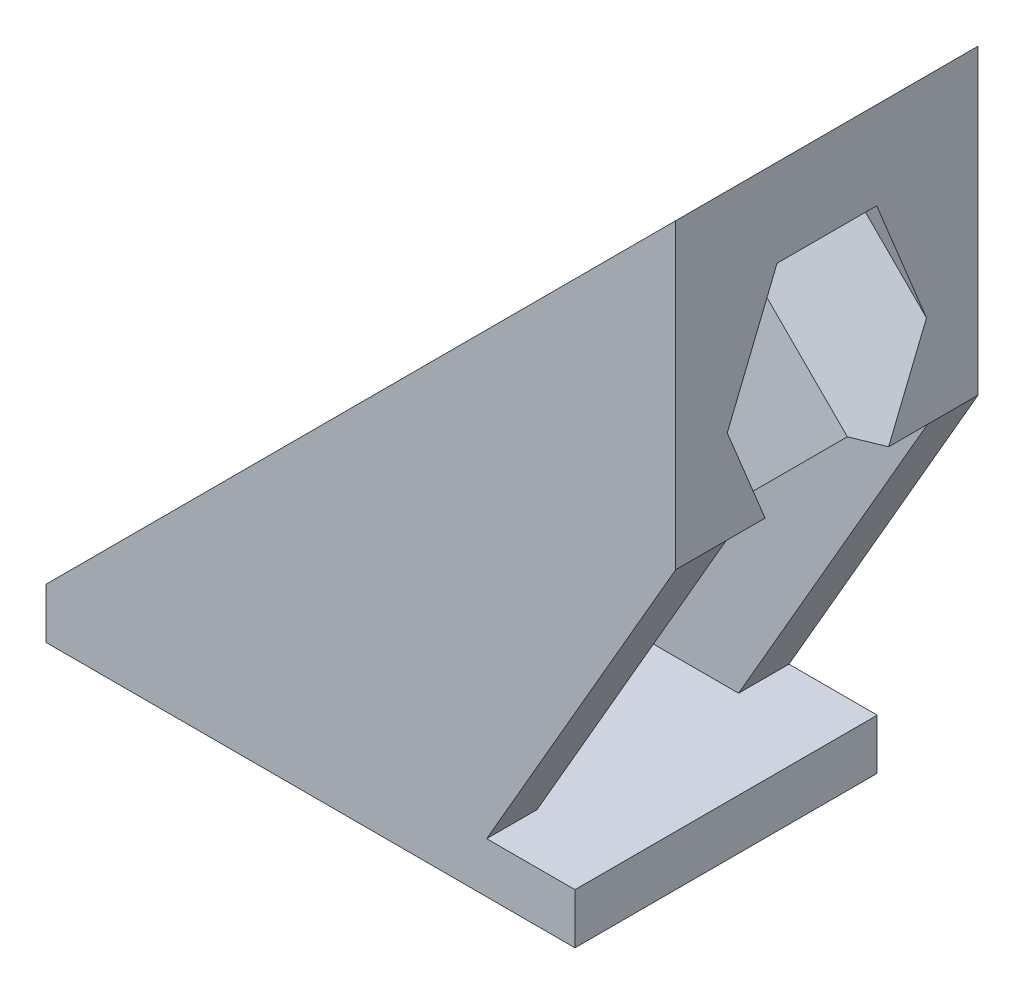
from build123d import *

# Parameters (mm, degrees)
SKETCH3_W           = 21
SKETCH3_H           = 2
BOSS_EXTRUDE1_DEPTH = 12
CUT_EXTRUDE1_START  = -2
CUT_EXTRUDE1_DEPTH  = 8
CUT_EXTRUDE8_START  = -2
CUT_EXTRUDE8_DEPTH  = 36.336309405
CUT_EXTRUDE9_DEPTH  = 38.336309405
CUT_EXTRUDE11_DEPTH = 2
FILLET1_R           = 10


with BuildPart() as part:
    # Sketch3 → Boss-Extrude1 (new body)
    with BuildSketch(Plane.XY):
        with Locations((10.5, -1)):
            Rectangle(SKETCH3_W, SKETCH3_H)
        Polygon((13, 13), (0, 0), (17.494446501, 0), (25, 13), align=None)
        Polygon((25, 25), (13, 13), (25, 13), align=None)
    extrude(amount=BOSS_EXTRUDE1_DEPTH)

    # Sketch4 → Cut-Extrude1 (cut)
    with BuildSketch(Plane.XY.offset(12).offset(CUT_EXTRUDE1_START)):
        Polygon((25, 13), (20, 13), (3, 0), (17.494446501, 0), align=None)
    extrude(amount=-CUT_EXTRUDE1_DEPTH, mode=Mode.SUBTRACT)

    # Sketch7 → Cut-Extrude8 (cut, through all)
    with BuildSketch(Plane(origin=(0, 0, 0), x_dir=(0, 0, 1), z_dir=(-0.7071067811865485, 0.7071067811865466, 0)).offset(CUT_EXTRUDE8_START)):
        Polygon((6, 26.047596513), (6, 32.897596513), (4.022575328, 32.897596513), (2.045150656, 29.472596513), (4.022575328, 26.047596513), align=None)
        Polygon((7.977424672, 32.897596513), (6, 32.897596513), (6, 26.047596513), (7.977424672, 26.047596513), (9.954849344, 29.472596513), align=None)
    extrude(amount=-CUT_EXTRUDE8_DEPTH, mode=Mode.SUBTRACT)

    # Sketch8 → Cut-Extrude9 (cut, through all)
    with BuildSketch(Plane(origin=(0, 0, 0), x_dir=(0, 0, 1), z_dir=(-0.7071067811865485, 0.7071067811865466, 0))):
        with BuildLine():
            ThreePointArc((8, 29.355339059), (7.414213562, 30.769552622), (6, 31.355339059))
            Line((6, 31.355339059), (6, 27.355339059))
            ThreePointArc((6, 27.355339059), (7.414213562, 27.941125497), (8, 29.355339059))
        make_face()
        with BuildLine():
            Line((6, 27.355339059), (6, 31.355339059))
            ThreePointArc((6, 31.355339059), (4, 29.355339059), (6, 27.355339059))
        make_face()
    extrude(amount=-CUT_EXTRUDE9_DEPTH, mode=Mode.SUBTRACT)

    # Sketch9 → Cut-Extrude11 (cut)
    with BuildSketch(Plane(origin=(0, 0, 0), x_dir=(1, 0, 0), z_dir=(0, 1, 0))):
        with BuildLine():
            ThreePointArc((7.24722325, -2), (5.358620419, -4.950446591), (5.869726291, -8.416096101))
            Line((5.869726291, -8.416096101), (8.496224466, -6.96643844))
            ThreePointArc((8.496224466, -6.96643844), (9.28078481, -4.249001216), (11.998222034, -5.03356156))
            Line((11.998222034, -5.03356156), (14.62472021, -3.583903899))
            ThreePointArc((14.62472021, -3.583903899), (14.020027676, -2.718849781), (13.24722325, -2))
            Line((13.24722325, -2), (7.24722325, -2))
        make_face()
        with BuildLine():
            Line((8.496224466, -6.96643844), (5.869726291, -8.416096101))
            ThreePointArc((5.869726291, -8.416096101), (6.474418824, -9.281150219), (7.24722325, -10))
            Line((7.24722325, -10), (13.24722325, -10))
            ThreePointArc((13.24722325, -10), (14.719359205, -8.236067977), (15.24722325, -6))
            ThreePointArc((15.24722325, -6), (15.089097102, -4.752499458), (14.62472021, -3.583903899))
            Line((14.62472021, -3.583903899), (11.998222034, -5.03356156))
            ThreePointArc((11.998222034, -5.03356156), (12.183972791, -5.500999783), (12.24722325, -6))
            ThreePointArc((12.24722325, -6), (10.746223467, -7.936749541), (8.496224466, -6.96643844))
        make_face()
        with BuildLine():
            ThreePointArc((11.998222034, -5.03356156), (9.28078481, -4.249001216), (8.496224466, -6.96643844))
            Line((8.496224466, -6.96643844), (11.998222034, -5.03356156))
        make_face()
        with BuildLine():
            Line((11.998222034, -5.03356156), (8.496224466, -6.96643844))
            ThreePointArc((8.496224466, -6.96643844), (10.746223467, -7.936749541), (12.24722325, -6))
            ThreePointArc((12.24722325, -6), (12.183972791, -5.500999783), (11.998222034, -5.03356156))
        make_face()
        with BuildLine():
            ThreePointArc((13.24722325, -2), (10.24722325, -1), (7.24722325, -2))
            Line((7.24722325, -2), (13.24722325, -2))
        make_face()
        with BuildLine():
            Line((13.24722325, -10), (7.24722325, -10))
            ThreePointArc((7.24722325, -10), (10.24722325, -11), (13.24722325, -10))
        make_face()
    extrude(amount=CUT_EXTRUDE11_DEPTH, mode=Mode.SUBTRACT)

    # Sketch13 → CSK for M4 Flat Head Machine Screw1 (revolve, cut)
    with BuildSketch(Plane(origin=(10.24722325, 0, 6), x_dir=(0, 0, 1), z_dir=(1, 0, 0))):
        Polygon((0, 0), (0, 2), (2.15, 2), (2.15, 2.55), (4.7, 0), align=None)
    revolve(axis=Axis((10.24722325, 6.35, 6), (0, -1, 0)), mode=Mode.SUBTRACT)

    # Fillet1
    fillet1_edges = [part.edges().sort_by_distance(p)[0] for p in [
        (20, 13, 6),
    ]]
    fillet(fillet1_edges, radius=FILLET1_R)


solid = part.part
